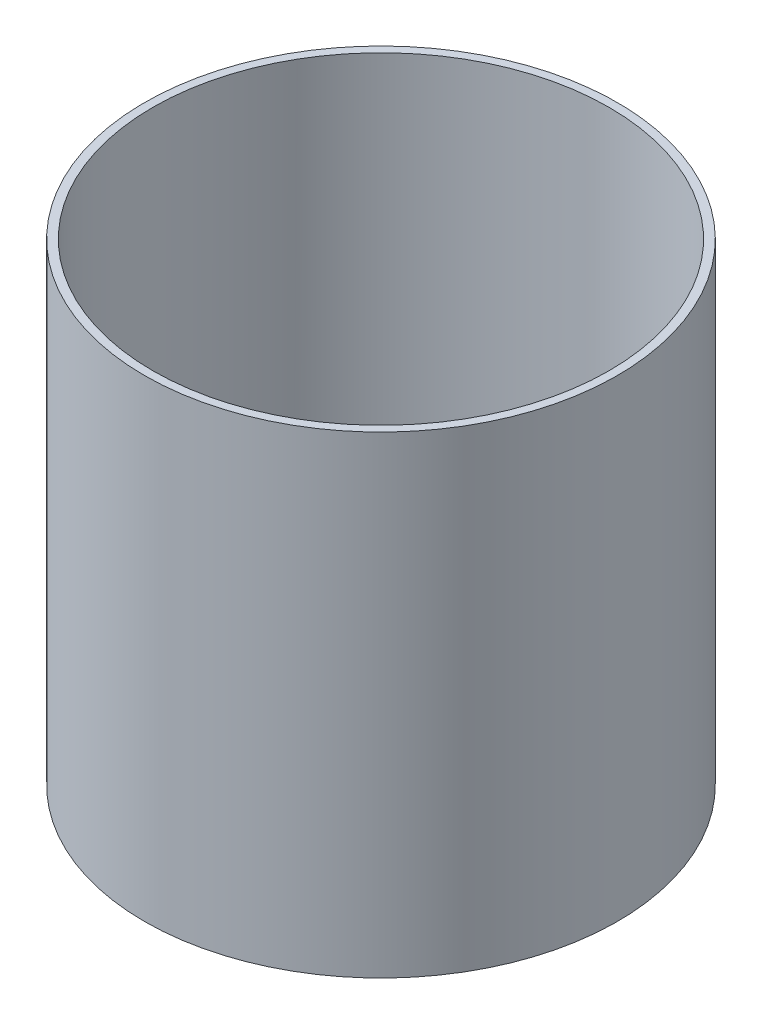
from build123d import *

# Parameters (mm, degrees)
SKETCH1_R           = 50
SKETCH1_R_2         = 48.25
BOSS_EXTRUDE1_DEPTH = 100
SKETCH2_R           = 50
BOSS_EXTRUDE2_DEPTH = 1.5
SKETCH3_R           = 7.25
CUT_EXTRUDE1_DEPTH  = 2.5


with BuildPart() as part:
    # Sketch1 → Boss-Extrude1 (new body)
    with BuildSketch(Plane(origin=(0, 0, 0), x_dir=(1, 0, 0), z_dir=(0, 1, 0))):
        with Locations(Location((0, 0, 0), (0, 0, 270))):
            Circle(SKETCH1_R)
        with Locations(Location((0, 0, 0), (0, 0, 270))):
            Circle(SKETCH1_R_2, mode=Mode.SUBTRACT)
    extrude(amount=BOSS_EXTRUDE1_DEPTH)

    # Sketch2 → Boss-Extrude2 (add)
    with BuildSketch(Plane.XZ):
        with Locations(Location((0, 0, 0), (0, 0, 90))):
            Circle(SKETCH2_R)
    extrude(amount=-BOSS_EXTRUDE2_DEPTH)

    # Sketch3 → Cut-Extrude1 (cut)
    with BuildSketch(Plane.XZ):
        with Locations(Location((-20, 0, 0), (0, 0, 270))):
            Circle(SKETCH3_R)
        with Locations(Location((20, 0, 0), (0, 0, 270))):
            Circle(SKETCH3_R)
    extrude(amount=-CUT_EXTRUDE1_DEPTH, mode=Mode.SUBTRACT)


solid = part.part
